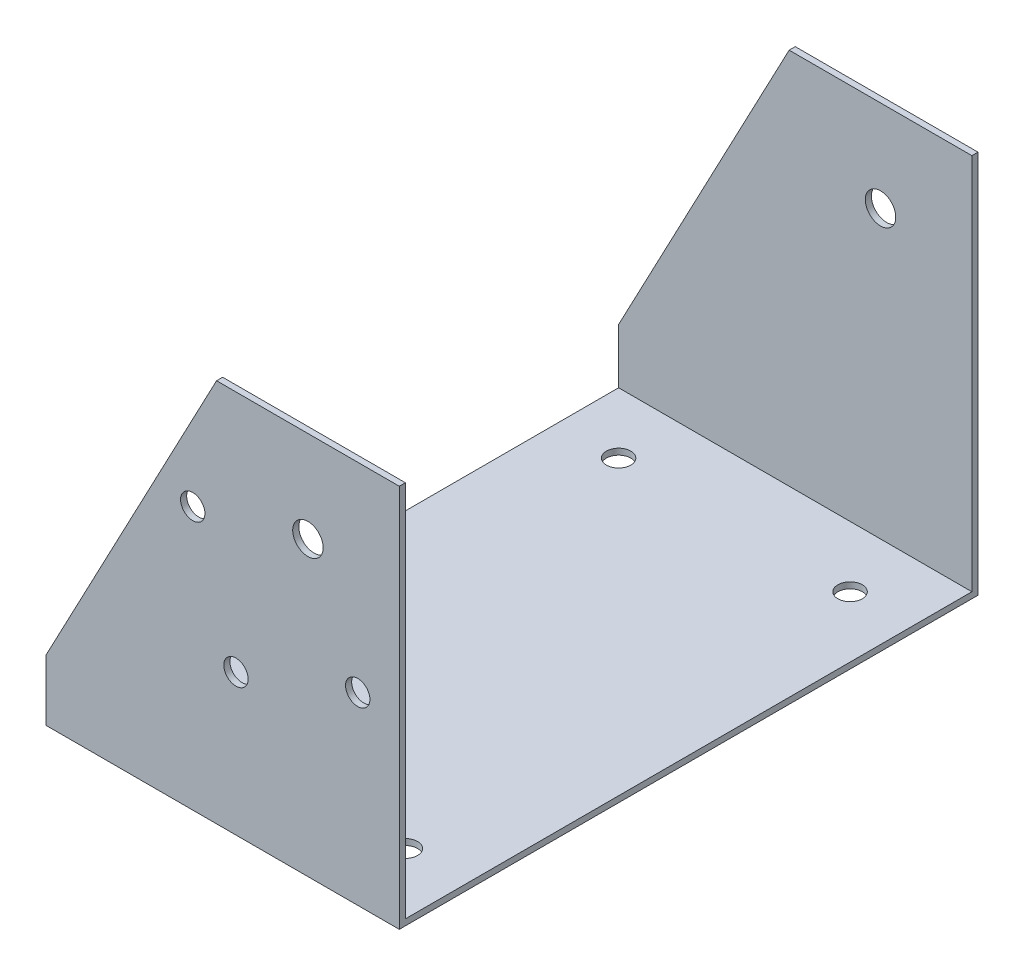
from build123d import *

# Parameters (mm, degrees)
CROQUIS1_W              = 58
CROQUIS1_H              = 95
SALIENTE_EXTRUIR4_DEPTH = 1
CROQUIS3_W              = 58
CROQUIS3_H              = 62
SALIENTE_EXTRUIR5_DEPTH = 1
CROQUIS4_W              = 58
CROQUIS4_H              = 62
SALIENTE_EXTRUIR6_DEPTH = 1
CORTAR_EXTRUIR4_DEPTH   = 1
CORTAR_EXTRUIR5_DEPTH   = 1
CROQUIS8_R              = 2.5
CORTAR_EXTRUIR6_DEPTH   = 1
CORTAR_EXTRUIR7_START   = -1
CROQUIS9_R              = 2.5
CORTAR_EXTRUIR7_DEPTH   = 1
CROQUIS10_R             = 2
CORTAR_EXTRUIR8_DEPTH   = 1
CROQUIS11_R             = 2
CORTAR_EXTRUIR9_DEPTH   = 1


with BuildPart() as part:
    # Croquis1 → Saliente-Extruir4 (new body)
    with BuildSketch(Plane(origin=(0, 0, 0), x_dir=(1, 0, 0), z_dir=(0, 1, 0))):
        Rectangle(CROQUIS1_W, CROQUIS1_H)
    extrude(amount=SALIENTE_EXTRUIR4_DEPTH)

    # Croquis3 → Saliente-Extruir5 (add)
    with BuildSketch(Plane.XY.offset(47.5)):
        with Locations((0, 32)):
            Rectangle(CROQUIS3_W, CROQUIS3_H)
    extrude(amount=-SALIENTE_EXTRUIR5_DEPTH)

    # Croquis4 → Saliente-Extruir6 (add)
    with BuildSketch(Plane(origin=(0, 0, -47.5), x_dir=(-1, 0, 0), z_dir=(0, 0, -1))):
        with Locations((0, 32)):
            Rectangle(CROQUIS4_W, CROQUIS4_H)
    extrude(amount=-SALIENTE_EXTRUIR6_DEPTH)

    # Croquis6 → Cortar-Extruir4 (cut)
    with BuildSketch(Plane(origin=(0, 0, -47.5), x_dir=(-1, 0, 0), z_dir=(0, 0, -1))):
        Polygon((1, 63), (29, 10), (29, 63), align=None)
    extrude(amount=-CORTAR_EXTRUIR4_DEPTH, mode=Mode.SUBTRACT)

    # Croquis7 → Cortar-Extruir5 (cut)
    with BuildSketch(Plane.XY.offset(47.5)):
        Polygon((-1, 63), (-29, 10), (-29, 63), align=None)
    extrude(amount=-CORTAR_EXTRUIR5_DEPTH, mode=Mode.SUBTRACT)

    # Croquis8 → Cortar-Extruir6 (cut)
    with BuildSketch(Plane.XY.offset(47.5)):
        with Locations((14, 48)):
            Circle(CROQUIS8_R)
    extrude(amount=-CORTAR_EXTRUIR6_DEPTH, mode=Mode.SUBTRACT)

    # Croquis9 → Cortar-Extruir7 (cut)
    with BuildSketch(Plane(origin=(0, 0, -47.5), x_dir=(-1, 0, 0), z_dir=(0, 0, -1)).offset(CORTAR_EXTRUIR7_START)):
        with Locations(Location((-14, 48, 0), (0, 0, 180))):
            Circle(CROQUIS9_R)
    extrude(amount=CORTAR_EXTRUIR7_DEPTH, mode=Mode.SUBTRACT)

    # Croquis10 → Cortar-Extruir8 (cut)
    with BuildSketch(Plane.XY.offset(47.5)):
        with Locations((-4.910218483, 43.157065968)):
            Circle(CROQUIS10_R)
        with Locations((2.184940403, 23.167473614)):
            Circle(CROQUIS10_R)
        with Locations((22.174532757, 30.267910044)):
            Circle(CROQUIS10_R)
    extrude(amount=-CORTAR_EXTRUIR8_DEPTH, mode=Mode.SUBTRACT)

    # Croquis11 → Cortar-Extruir9 (cut)
    with BuildSketch(Plane(origin=(0, 1, 0), x_dir=(1, 0, 0), z_dir=(0, 1, 0))):
        with Locations(Location((-19, 36.5, 0), (0, 0, 270))):
            Circle(CROQUIS11_R)
        with Locations(Location((19, 36.5, 0), (0, 0, 90))):
            Circle(CROQUIS11_R)
        with Locations(Location((19, -36.5, 0), (0, 0, 270))):
            Circle(CROQUIS11_R)
        with Locations(Location((-19, -36.5, 0), (0, 0, 90))):
            Circle(CROQUIS11_R)
    extrude(amount=-CORTAR_EXTRUIR9_DEPTH, mode=Mode.SUBTRACT)


solid = part.part
